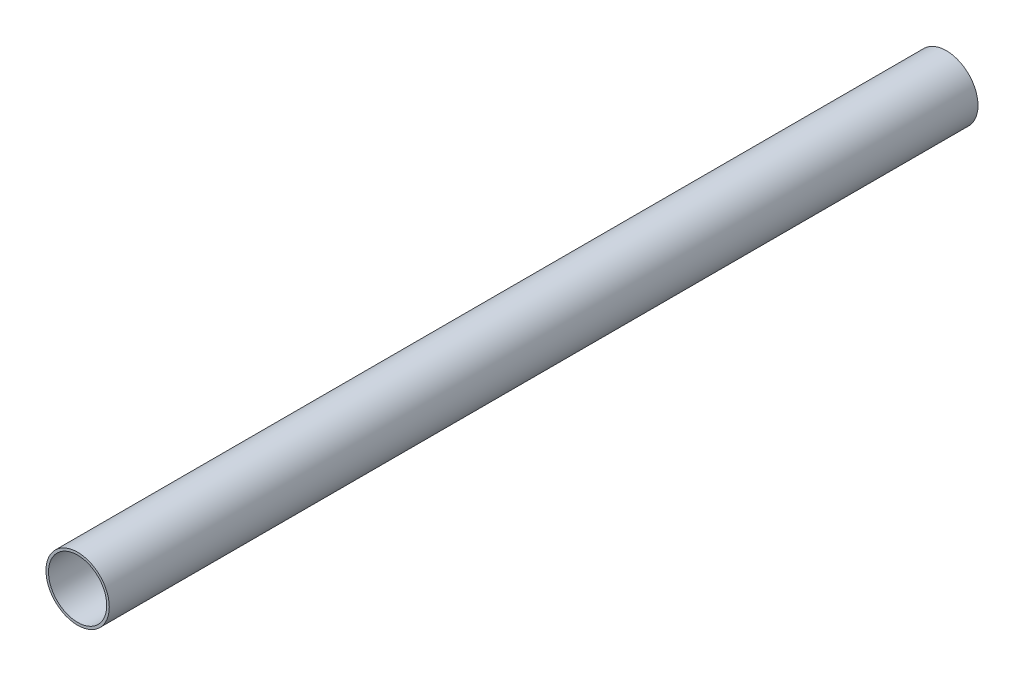
from build123d import *

# Parameters (mm, degrees)
BOSS_EXTRUDE1_DEPTH      = 152.4
BOSS_EXTRUDE1_DEPTH_BACK = 152.4
SKETCH3_R                = 11.1125
SKETCH3_R_2              = 10.2235


with BuildPart() as part:
    # Sketch3 → Boss-Extrude1 (new, two sides: drawn at the far end of the back side and taken through both)
    with BuildSketch(Plane.XY.offset(-BOSS_EXTRUDE1_DEPTH_BACK)):
        Circle(SKETCH3_R)
        Circle(SKETCH3_R_2, mode=Mode.SUBTRACT)
    extrude(amount=BOSS_EXTRUDE1_DEPTH + BOSS_EXTRUDE1_DEPTH_BACK)


solid = part.part
